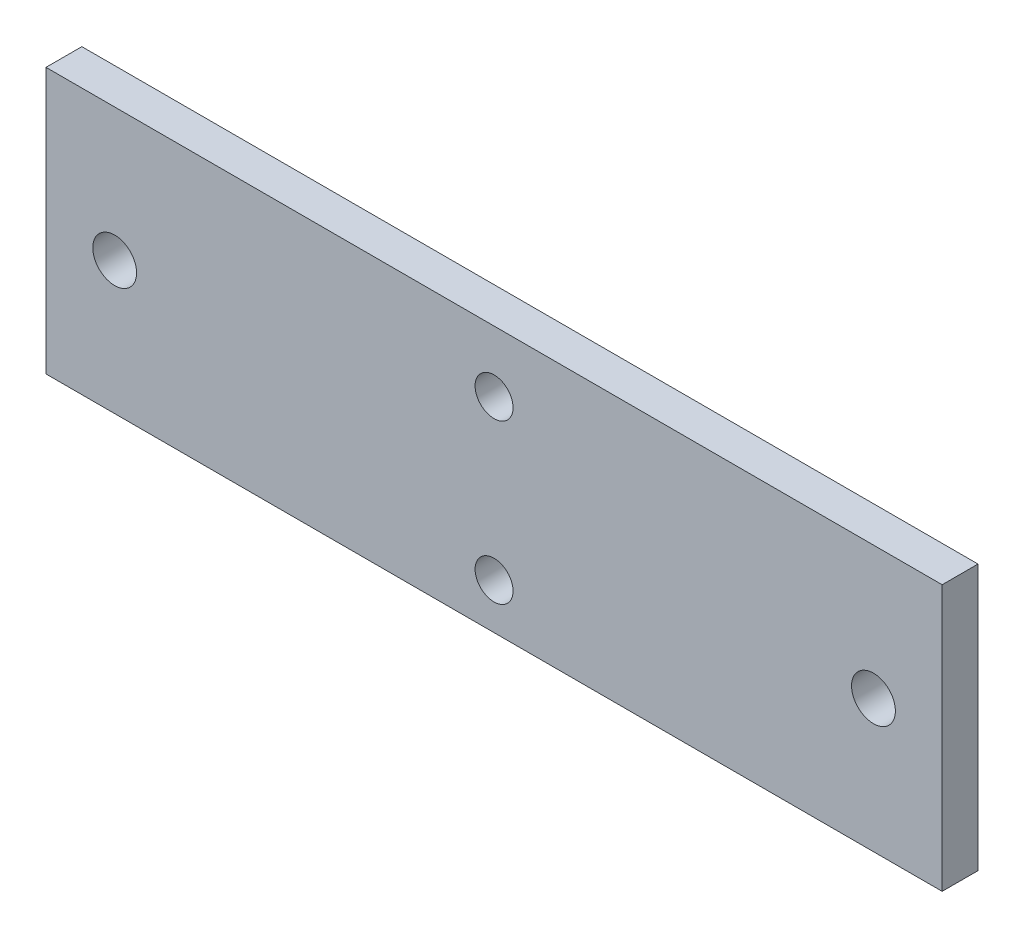
from build123d import *

# Parameters (mm, degrees)
SKETCH1_W           = 150
SKETCH1_H           = 44.45
BOSS_EXTRUDE1_DEPTH = 6
SKETCH2_R           = 3.666174209
CUT_EXTRUDE1_DEPTH  = 157.562455589
SKETCH3_R           = 3.175
CUT_EXTRUDE2_DEPTH  = 157.562455589


with BuildPart() as part:
    # Sketch1 → Boss-Extrude1 (new body)
    with BuildSketch(Plane.XY):
        with Locations((75, 22.225)):
            Rectangle(SKETCH1_W, SKETCH1_H)
    extrude(amount=BOSS_EXTRUDE1_DEPTH)

    # Sketch2 → Cut-Extrude1 (cut, through all)
    with BuildSketch(Plane.XY.offset(6)):
        with Locations((11.495, 22.225)):
            Circle(SKETCH2_R)
        with Locations(Location((138.505, 22.225, 0), (0, 0, 180))):
            Circle(SKETCH2_R)
    extrude(amount=-CUT_EXTRUDE1_DEPTH, mode=Mode.SUBTRACT)

    # Sketch3 → Cut-Extrude2 (cut, through all)
    with BuildSketch(Plane(origin=(0, 0, 0), x_dir=(-1, 0, 0), z_dir=(0, 0, -1))):
        with Locations((-75, 7.62)):
            Circle(SKETCH3_R)
        with Locations((-75, 34.197995036)):
            Circle(SKETCH3_R)
    extrude(amount=-CUT_EXTRUDE2_DEPTH, mode=Mode.SUBTRACT)


solid = part.part
